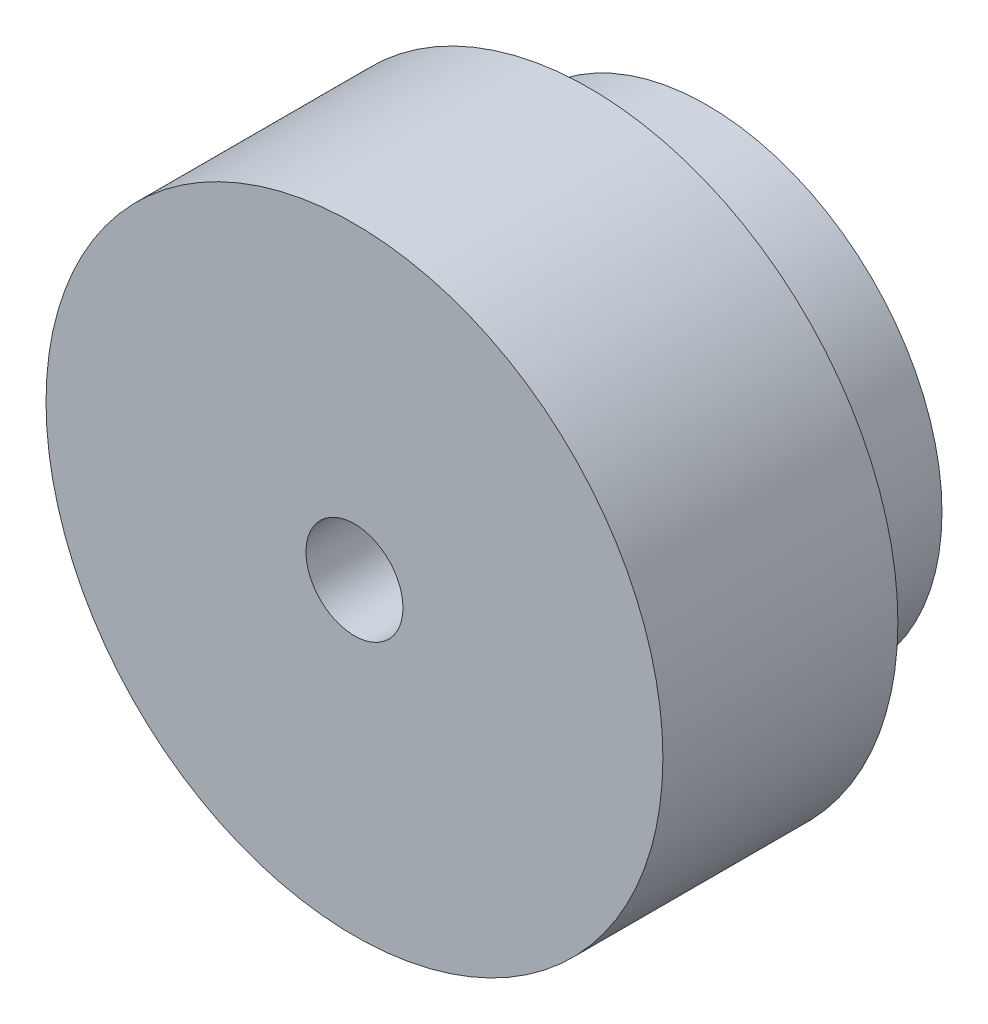
from build123d import *


with BuildPart() as part:
    # Sketch1 → Revolve1 (revolve)
    with BuildSketch(Plane(origin=(0, 0, 0), x_dir=(0, 0, -1), z_dir=(1, 0, 0)), mode=Mode.PRIVATE) as revolve1_sk:
        Polygon((0, 3.302), (-24, 3.302), (-24, 21), (-8, 21), (-8, 16.002), (0, 16.002), align=None)
    revolve(revolve1_sk.sketch.rotate(Axis((0, 0, 0), (0, 0, -1)), 90), axis=Axis((0, 0, 0), (0, 0, -1)))


solid = part.part
